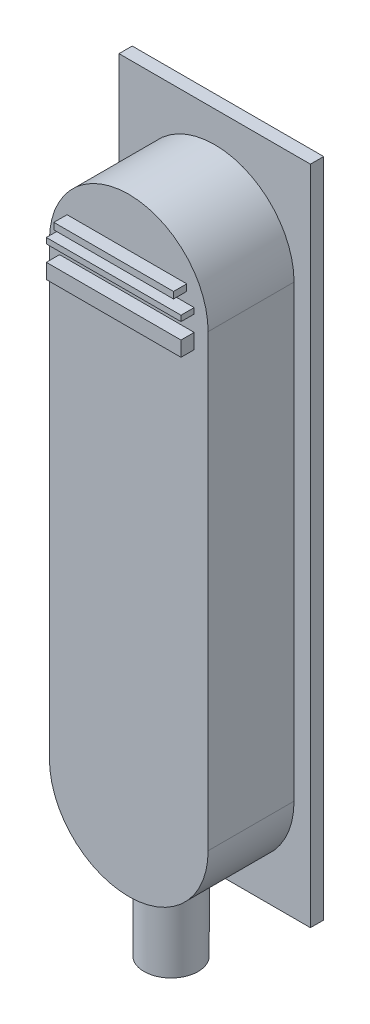
from build123d import *

# Parameters (mm, degrees)
SKETCH1_W           = 14.477015864
SKETCH1_H           = 50.012098532
BOSS_EXTRUDE1_DEPTH = 1
BOSS_EXTRUDE2_DEPTH = 6.5
SKETCH4_W           = 9.051394426
SKETCH4_H           = 0.494998133
SKETCH4_W_2         = 10.182818728
SKETCH4_H_2         = 0.424284113
SKETCH4_H_3         = 1.131424304
BOSS_EXTRUDE4_DEPTH = 1
SCALE1_SCALE        = 0.5
SCALE2_SCALE        = 0.5
SKETCH5_R           = 0.511212816
BOSS_EXTRUDE5_DEPTH = 1.35
SKETCH7_R           = 0.511212816
BOSS_EXTRUDE6_DEPTH = 1.35


with BuildPart() as part:
    # Sketch1 → Boss-Extrude1 (new body)
    with BuildSketch(Plane.XY):
        Rectangle(SKETCH1_W, SKETCH1_H)
    extrude(amount=BOSS_EXTRUDE1_DEPTH)

    # Sketch2 → Boss-Extrude2 (add)
    with BuildSketch(Plane.XY.offset(1)):
        with BuildLine():
            Line((6, 16.665360906), (6, -17.334639094))
            ThreePointArc((6, -17.334639094), (0, -23.334639094), (-6, -17.334639094))
            Line((-6, -17.334639094), (-6, 16.665360906))
            ThreePointArc((-6, 16.665360906), (0, 22.665360906), (6, 16.665360906))
        make_face()
    extrude(amount=BOSS_EXTRUDE2_DEPTH)

    # Sketch4 → Boss-Extrude4 (add)
    with BuildSketch(Plane.XY.offset(7.5)):
        with Locations((-0.141428038, 18.743662091)):
            Rectangle(SKETCH4_W, SKETCH4_H)
        with Locations((-0.141428038, 17.506166759)):
            Rectangle(SKETCH4_W_2, SKETCH4_H_2)
        with Locations((-0.141428038, 15.526174228)):
            Rectangle(SKETCH4_W_2, SKETCH4_H_3)
    extrude(amount=BOSS_EXTRUDE4_DEPTH)


with BuildPart() as part_1:
    # Scale1: scaled about (-0.000695656, -0.192418976, 3.611272537)
    add(part.part.scale(SCALE1_SCALE).moved(Location((-0.000347828, -0.096209488, 1.805636269))))


with BuildPart() as part_2:
    # Scale2: scaled about (-0.000695656, -0.192418976, 3.611272537)
    add(part_1.part.scale(SCALE2_SCALE).moved(Location((-0.000347828, -0.096209488, 1.805636269))))



with BuildPart() as body_2:
    # Sketch5 → Boss-Extrude5 (new body)
    with BuildSketch(Plane(origin=(0, -6, 0), x_dir=(1, 0, 0), z_dir=(0, 1, 0))):
        with Locations(Location((0, -3.78422441, 0), (0, 0, 270))):
            Circle(SKETCH5_R)
    extrude(amount=-BOSS_EXTRUDE5_DEPTH)


with BuildPart() as part_3:
    add(part_2.part)

    add(body_2.part)  # Boss-Extrude6 merges body 2
    # Sketch7 → Boss-Extrude6 (add)
    with BuildSketch(Plane(origin=(0, -6, 0), x_dir=(1, 0, 0), z_dir=(0, 1, 0))):
        with Locations(Location((0, -3.78422441, 0), (0, 0, 90))):
            Circle(SKETCH7_R)
    extrude(amount=BOSS_EXTRUDE6_DEPTH)


solid = part_3.part
